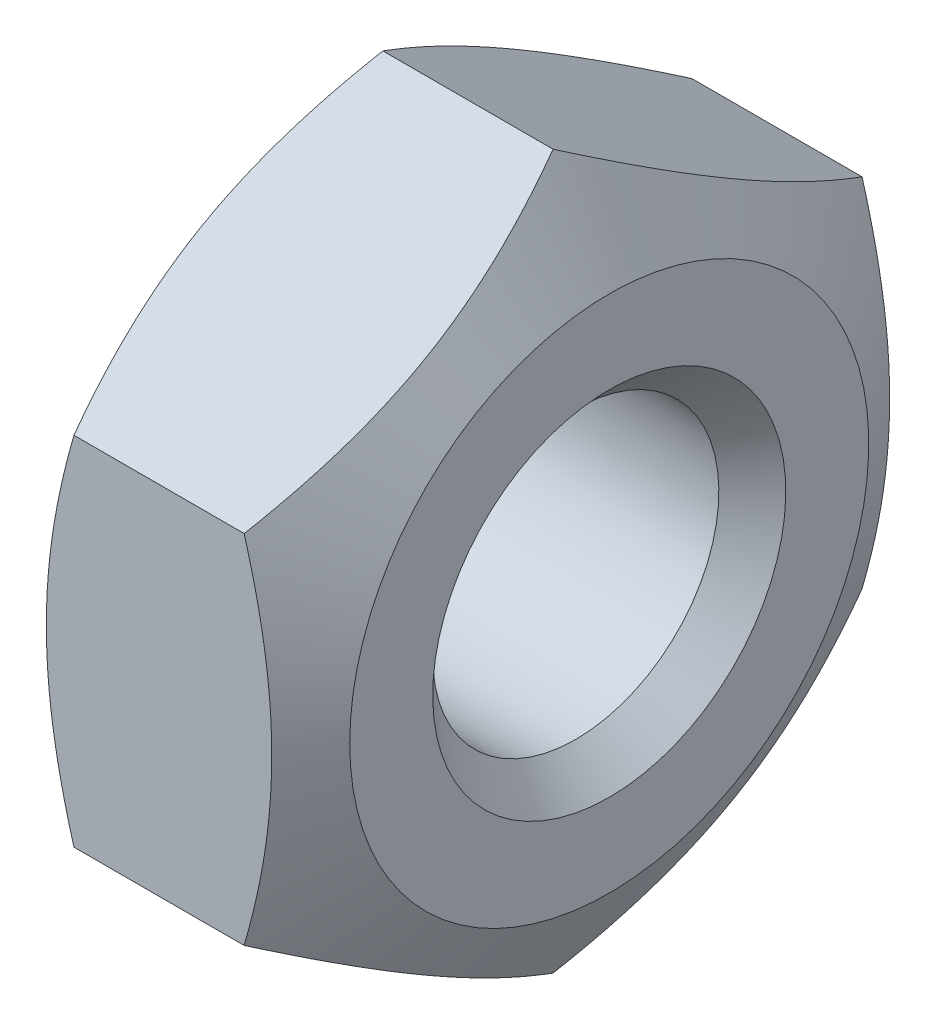
from build123d import *

# Parameters (mm, degrees)
EXTRUDE_1_DEPTH      = 1.6
EXTRUDE_1_DEPTH_BACK = 1.6


with BuildPart() as part:
    # 草图1 → 凸台-拉伸1 (new, two sides: drawn at the far end of the back side and taken through both)
    with BuildSketch(Plane(origin=(0, 0, 0), x_dir=(0, 0, -1), z_dir=(1, 0, 0)).offset(-EXTRUDE_1_DEPTH_BACK)):
        Polygon((-3.5, -2.020725942), (0, -4.041451884), (3.5, -2.020725942), (3.5, 2.020725942), (0, 4.041451884), (-3.5, 2.020725942), align=None)
    extrude(amount=EXTRUDE_1_DEPTH + EXTRUDE_1_DEPTH_BACK)

    # 草图2 → 切除-旋转1 (revolve, cut)
    with BuildSketch(Plane.XY):
        Polygon((-1.6, 0), (-1.6, 2), (-1.221, 1.621), (1.221, 1.621), (1.6, 2), (1.6, 0), align=None)
    revolve(axis=Axis((1.6, 0, 0), (-1, 0, 0)), mode=Mode.SUBTRACT)

    # 草图3 → 切除-旋转2 (revolve, cut)
    with BuildSketch(Plane.XY):
        Polygon((-6.6, 6.94), (-6.6, 1), (-1.6, 1), (-1.6, 2.94), (0, 5.711281292), (1.6, 2.94), (1.6, 1), (6.6, 1), (6.6, 6.94), align=None)
    revolve(axis=Axis((50, 0, 0), (-1, 0, 0)), mode=Mode.SUBTRACT)


solid = part.part
